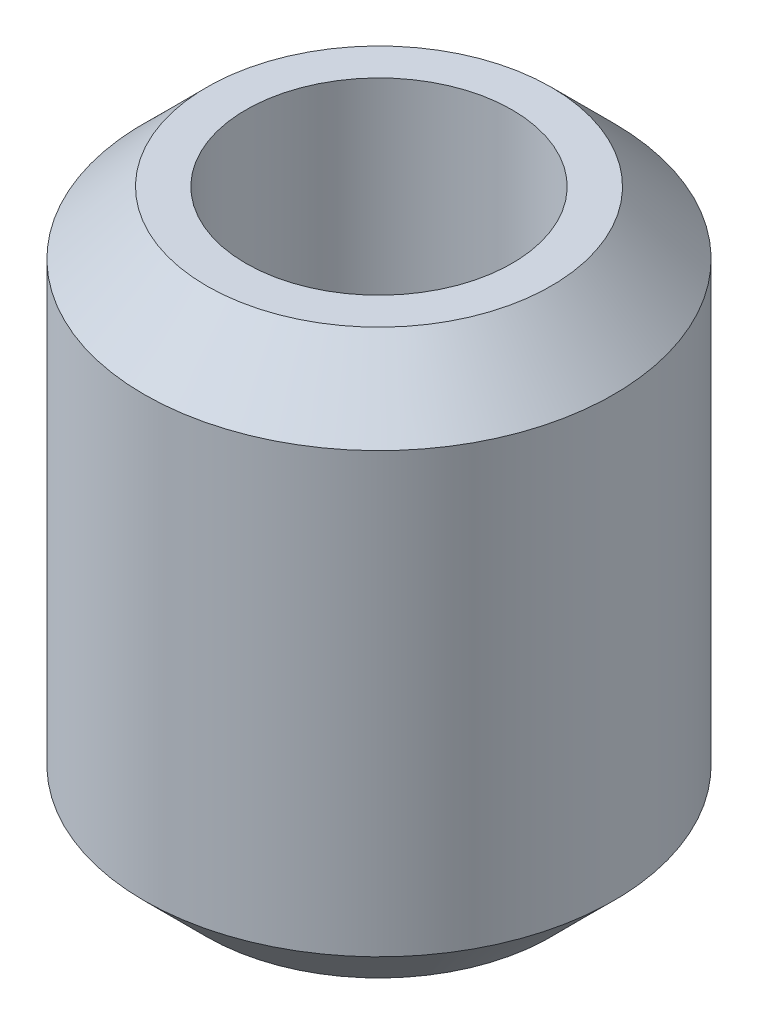
from build123d import *

# Parameters (mm, degrees)
SKETCH_1_R      = 7.5
SKETCH_1_R_2    = 4.25
EXTRUDE_1_DEPTH = 18
CHAMFER_1_SIZE  = 2


with BuildPart() as part:
    # Эскиз1 → Бобышка-Вытянуть1 (new body)
    with BuildSketch(Plane(origin=(0, 0, 0), x_dir=(1, 0, 0), z_dir=(0, 1, 0))):
        with Locations(Location((0, 0, 0), (0, 0, 270))):
            Circle(SKETCH_1_R)
        with Locations(Location((0, 0, 0), (0, 0, 270))):
            Circle(SKETCH_1_R_2, mode=Mode.SUBTRACT)
    extrude(amount=EXTRUDE_1_DEPTH)

    # Фаска1
    chamfer_1_edges = [part.edges().sort_by_distance(p)[0] for p in [
        (0, 0, -7.5),
        (0, 18, -7.5),
    ]]
    chamfer(chamfer_1_edges, length=CHAMFER_1_SIZE)


solid = part.part
